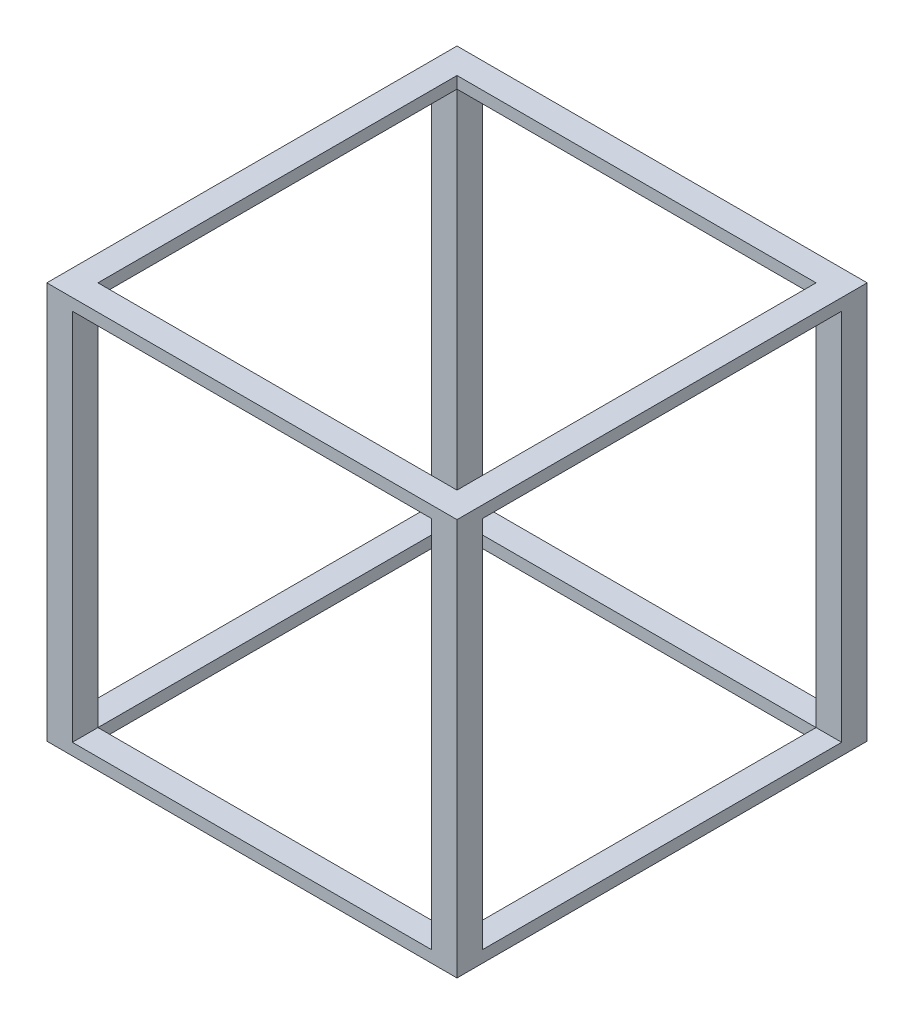
from build123d import *

# Parameters (mm, degrees)
SKETCH1_W           = 104.360997228
SKETCH1_H           = 104.360997228
SKETCH1_W_2         = 91.360997228
SKETCH1_H_2         = 91.360997228
BOSS_EXTRUDE1_DEPTH = 3
SKETCH2_W           = 6.5
SKETCH2_H           = 6.5
BOSS_EXTRUDE2_DEPTH = 95
SKETCH3_W           = 104.360997228
SKETCH3_H           = 104.360997228
SKETCH3_W_2         = 91.360997228
SKETCH3_H_2         = 91.360997228
BOSS_EXTRUDE3_DEPTH = 3


with BuildPart() as part:
    # Sketch1 → Boss-Extrude1 (new body)
    with BuildSketch(Plane(origin=(0, 0, 0), x_dir=(1, 0, 0), z_dir=(0, 1, 0))):
        Rectangle(SKETCH1_W, SKETCH1_H)
        Rectangle(SKETCH1_W_2, SKETCH1_H_2, mode=Mode.SUBTRACT)
    extrude(amount=BOSS_EXTRUDE1_DEPTH)

    # Sketch2 → Boss-Extrude2 (add)
    with BuildSketch(Plane(origin=(0, 3, 0), x_dir=(1, 0, 0), z_dir=(0, 1, 0))):
        with Locations((-48.930498614, 48.930498614)):
            Rectangle(SKETCH2_W, SKETCH2_H)
        with Locations((48.930498614, 48.930498614)):
            Rectangle(SKETCH2_W, SKETCH2_H)
        with Locations((-48.930498614, -48.930498614)):
            Rectangle(SKETCH2_W, SKETCH2_H)
        with Locations((48.930498614, -48.930498614)):
            Rectangle(SKETCH2_W, SKETCH2_H)
    extrude(amount=BOSS_EXTRUDE2_DEPTH)

    # Sketch3 → Boss-Extrude3 (add)
    with BuildSketch(Plane(origin=(0, 98, 0), x_dir=(1, 0, 0), z_dir=(0, 1, 0))):
        Rectangle(SKETCH3_W, SKETCH3_H)
        Rectangle(SKETCH3_W_2, SKETCH3_H_2, mode=Mode.SUBTRACT)
    extrude(amount=BOSS_EXTRUDE3_DEPTH)


solid = part.part
